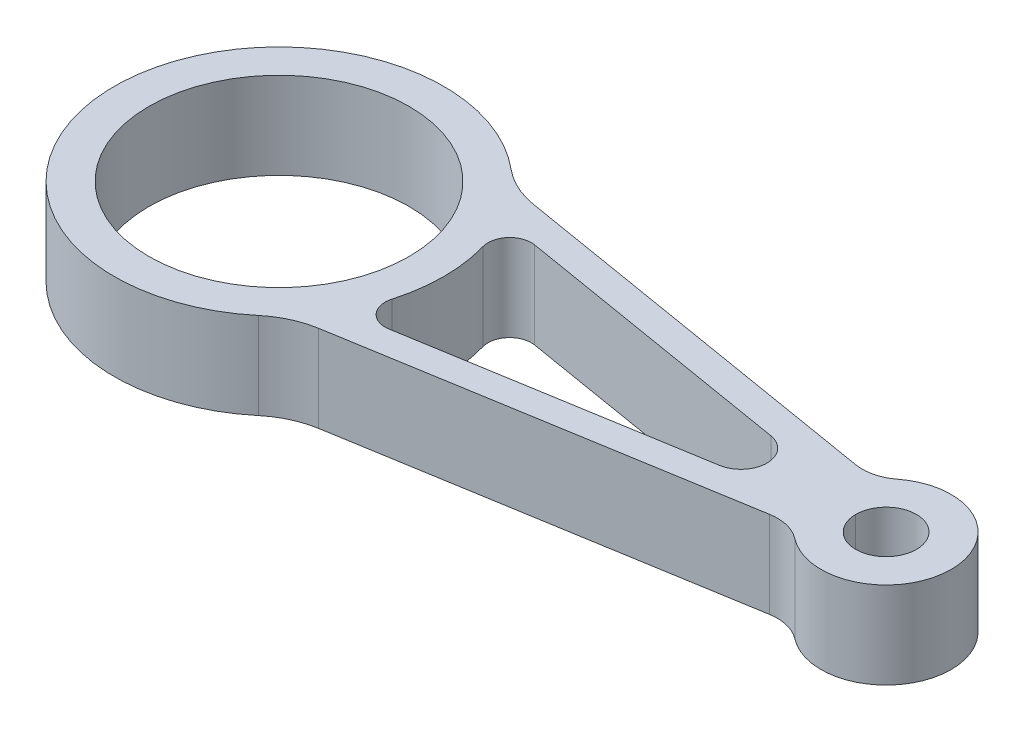
from build123d import *

# Parameters (mm, degrees)
SKETCH1_R           = 30
SKETCH1_R_2         = 7
BOSS_EXTRUDE1_DEPTH = 10
FILLET1_R           = 10
FILLET2_R           = 20
CUT_EXTRUDE1_DEPTH  = 65


with BuildPart() as part:
    # Sketch1 → Boss-Extrude1 (new, symmetric)
    with BuildSketch(Plane(origin=(0, 0, 0), x_dir=(1, 0, 0), z_dir=(0, 1, 0))):
        with BuildLine():
            Line((128.063755469, 9.084385863), (27.935473676, 25.760615491))
            ThreePointArc((27.935473676, 25.760615491), (-38, 0), (27.935473676, -25.760615491))
            Line((27.935473676, -25.760615491), (128.063755469, -9.084385863))
            ThreePointArc((128.063755469, -9.084385863), (155, 0), (128.063755469, 9.084385863))
        make_face()
        with Locations(Location((0, 0, 0), (0, 0, 270))):
            Circle(SKETCH1_R, mode=Mode.SUBTRACT)
        with Locations(Location((140, 0, 0), (0, 0, 270))):
            Circle(SKETCH1_R_2, mode=Mode.SUBTRACT)
    extrude(amount=BOSS_EXTRUDE1_DEPTH, both=True)

    # Fillet1
    fillet1_edges = [part.edges().sort_by_distance(p)[0] for p in [
        (128.063755469, 0, 9.084385863),
        (128.063755469, 0, -9.084385863),
    ]]
    fillet(fillet1_edges, radius=FILLET1_R)

    # Fillet2
    fillet2_edges = [part.edges().sort_by_distance(p)[0] for p in [
        (27.935473676, 0, 25.760615491),
        (27.935473676, 0, -25.760615491),
    ]]
    fillet(fillet2_edges, radius=FILLET2_R)

    # Sketch2 → Cut-Extrude1 (cut)
    with BuildSketch(Plane(origin=(0, 10, 0), x_dir=(1, 0, 0), z_dir=(0, 1, 0))):
        with BuildLine():
            Line((42.150179221, 16.803642214), (107.507453416, 5.918476776))
            ThreePointArc((107.507453416, 5.918476776), (112.52173913, 0), (107.507453416, -5.918476776))
            Line((107.507453416, -5.918476776), (42.150179221, -16.803642214))
            ThreePointArc((42.150179221, -16.803642214), (37.596406424, -15.198680064), (36.523081969, -10.491162161))
            ThreePointArc((36.523081969, -10.491162161), (38, 0), (36.523081969, 10.491162161))
            ThreePointArc((36.523081969, 10.491162161), (37.596406424, 15.198680064), (42.150179221, 16.803642214))
        make_face()
    extrude(amount=-CUT_EXTRUDE1_DEPTH, mode=Mode.SUBTRACT)


solid = part.part
